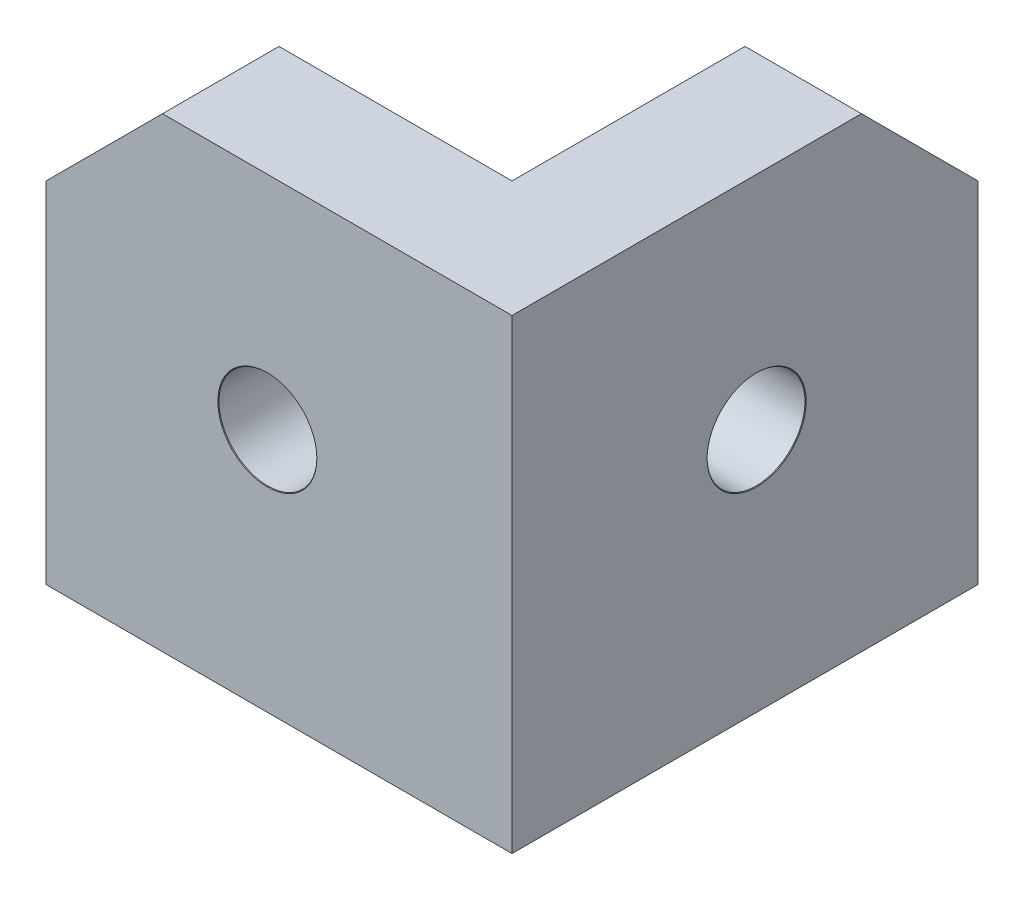
from build123d import *

# Parameters (mm, degrees)
BOSS_EXTRUDE1_DEPTH                   = 5
TAP_DRILL_FOR_M5X0_8_TAP1_D           = 4.2
TAP_DRILL_FOR_M5X0_8_TAP1_CSINK_D     = 4.25
TAP_DRILL_FOR_M5X0_8_TAP1_CSINK_ANGLE = 90
SKETCH4_W                             = 5
SKETCH4_H                             = 15
SKETCH4_H_2                           = 5
SKETCH4_W_2                           = 15
BOSS_EXTRUDE2_DEPTH                   = 15
TAP_DRILL_FOR_M5X0_8_TAP2_D           = 4.2
TAP_DRILL_FOR_M5X0_8_TAP2_CSINK_D     = 4.25
TAP_DRILL_FOR_M5X0_8_TAP2_CSINK_ANGLE = 90
TAP_DRILL_FOR_M5X0_8_TAP3_D           = 4.2
TAP_DRILL_FOR_M5X0_8_TAP3_CSINK_D     = 4.25
TAP_DRILL_FOR_M5X0_8_TAP3_CSINK_ANGLE = 90
CHAMFER1_SIZE                         = 5


with BuildPart() as part:
    # Sketch1 → Boss-Extrude1 (new body)
    with BuildSketch(Plane(origin=(0, 0, 0), x_dir=(1, 0, 0), z_dir=(0, 1, 0))):
        Polygon((9.5, 0), (20, 0), (20, 20), (0, 20), (0, 0), align=None)
    extrude(amount=BOSS_EXTRUDE1_DEPTH)

    # Tap Drill for M5x0.8 Tap1 (through all)
    with Locations(Plane(origin=(0, 0, 0), x_dir=(-1, 0, 0), z_dir=(0, -1, 0))):
        with Locations((-9.5, 10.5)):
            CounterSinkHole(TAP_DRILL_FOR_M5X0_8_TAP1_D / 2, TAP_DRILL_FOR_M5X0_8_TAP1_CSINK_D / 2, counter_sink_angle=TAP_DRILL_FOR_M5X0_8_TAP1_CSINK_ANGLE)

    # Sketch4 → Boss-Extrude2 (add)
    with BuildSketch(Plane(origin=(0, 5, 0), x_dir=(1, 0, 0), z_dir=(0, 1, 0))):
        with Locations((17.5, 12.5)):
            Rectangle(SKETCH4_W, SKETCH4_H)
        with Locations((17.5, 2.5)):
            Rectangle(SKETCH4_W, SKETCH4_H_2)
        with Locations((7.5, 2.5)):
            Rectangle(SKETCH4_W_2, SKETCH4_H_2)
    extrude(amount=BOSS_EXTRUDE2_DEPTH)

    # Tap Drill for M5x0.8 Tap2 (through all)
    with Locations(Plane.XY):
        with Locations((9.5, 10.5)):
            CounterSinkHole(TAP_DRILL_FOR_M5X0_8_TAP2_D / 2, TAP_DRILL_FOR_M5X0_8_TAP2_CSINK_D / 2, counter_sink_angle=TAP_DRILL_FOR_M5X0_8_TAP2_CSINK_ANGLE)

    # Tap Drill for M5x0.8 Tap3 (through all)
    with Locations(Plane(origin=(20, 0, 0), x_dir=(0, 0, -1), z_dir=(1, 0, 0))):
        with Locations((10.5, 10.5)):
            CounterSinkHole(TAP_DRILL_FOR_M5X0_8_TAP3_D / 2, TAP_DRILL_FOR_M5X0_8_TAP3_CSINK_D / 2, counter_sink_angle=TAP_DRILL_FOR_M5X0_8_TAP3_CSINK_ANGLE)

    # Chamfer1
    chamfer1_edges = [part.edges().sort_by_distance(p)[0] for p in [
        (0, 20, -2.5),
        (17.5, 20, -20),
        (0, 2.5, -20),
    ]]
    chamfer(chamfer1_edges, length=CHAMFER1_SIZE)


solid = part.part
